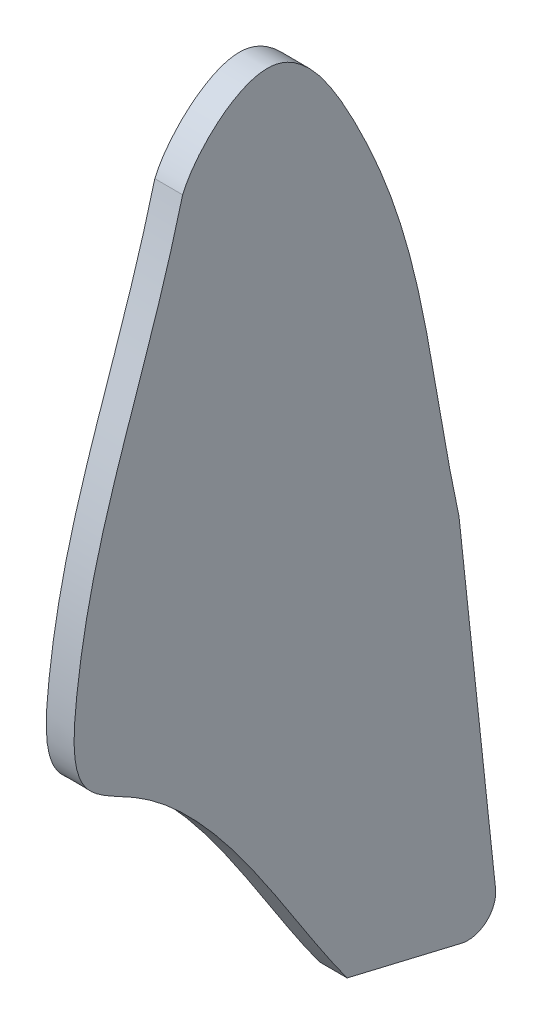
from build123d import *

# Parameters (mm, degrees)
BOSS_EXTRUDE1_DEPTH = 2.54


with BuildPart() as part:
    # Sketch4 → Boss-Extrude1 (new body)
    with BuildSketch(Plane(origin=(14.410345648, -0.087397068, -0.018595031), x_dir=(-0.0012903459702674255, 7.825798046814508e-06, -0.9999991674726704), z_dir=(0.9999807765891038, -0.00606476696064792, -0.0012903697013261176))):
        with BuildLine():
            Line((-673.23388139, -268.439845584), (-669.697289611, -299.796954957))
            ThreePointArc((-669.697289611, -299.796954957), (-670.538692498, -301.984376941), (-672.812625714, -302.55182869))
            Line((-672.812625714, -302.55182869), (-683.289599108, -300.043764168))
            add(Edge.make_bspline(
                [(-698.777503586, -230.045780827), (-702.239481244, -243.820989149), (-707.91758462, -253.974369427), (-708.807101651, -273.076479743), (-702.447530567, -275.77491742), (-693.236188435, -283.560922076), (-688.113234863, -293.442411233), (-683.289599108, -300.043764168)],
                knots=[0, 0, 0, 0, 0.4559936, 0.54805304, 0.607593539, 0.690343512, 1, 1, 1, 1], degree=3))
            add(Edge.make_bspline(
                [(-698.777503586, -230.045780827), (-697.681342144, -227.364330807), (-690.206209311, -220.133784938), (-676.392871954, -241.853359273), (-676.265874744, -254.746858664), (-673.23388139, -268.439845584)],
                knots=[0, 0, 0, 0, 0.170248555, 0.356058161, 1, 1, 1, 1], degree=3))
        make_face()
    extrude(amount=BOSS_EXTRUDE1_DEPTH)


solid = part.part
